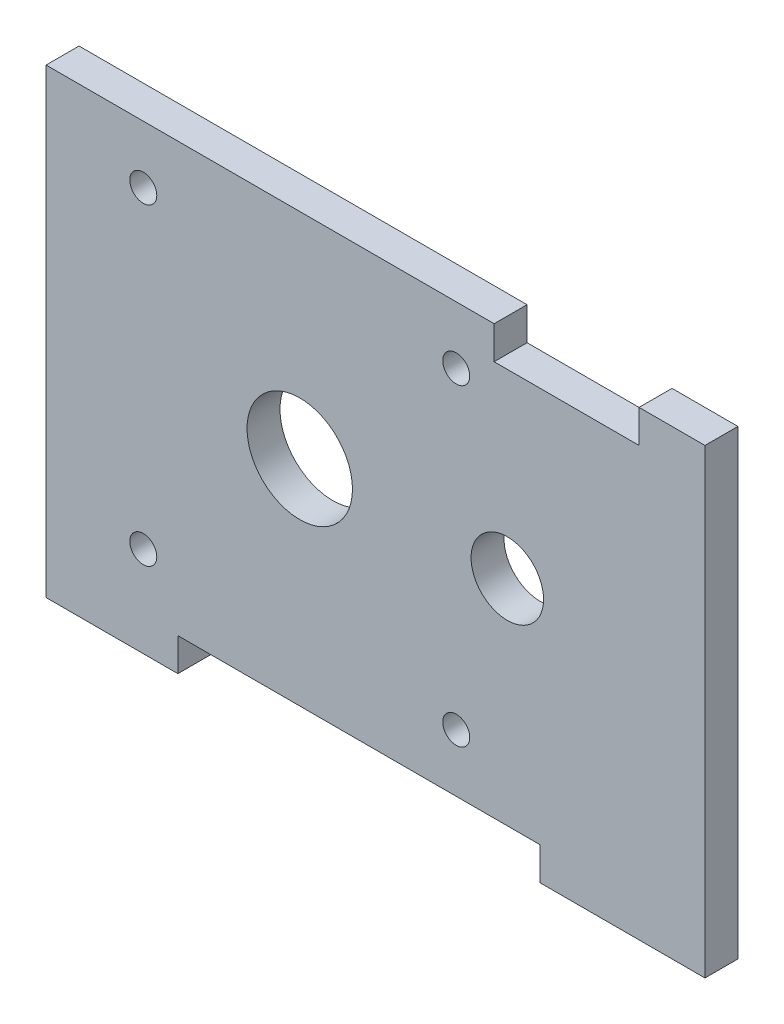
from build123d import *

# Parameters (mm, degrees)
SKETCH1_W           = 127
SKETCH1_H           = 82.55
SKETCH1_R           = 10.16
SKETCH1_R_2         = 6.985
SKETCH1_W_2         = 25.4
SKETCH1_H_2         = 6.35
SKETCH1_W_3         = 31.75
BOSS_EXTRUDE1_DEPTH = 6.35
SKETCH3_R           = 2.6035
CUT_EXTRUDE1_DEPTH  = 152.604172106
SKETCH4_W           = 27.94
SKETCH4_H           = 6.35
CUT_EXTRUDE2_DEPTH  = 6.35


with BuildPart() as part:
    # Sketch1 → Boss-Extrude1 (new body)
    # profile 1 of 3: a face of its own
    with BuildSketch(Plane.XY):
        with Locations((-63.5, 41.275)):
            Rectangle(SKETCH1_W, SKETCH1_H)
        with Locations((-78.105, 41.275)):
            Circle(SKETCH1_R, mode=Mode.SUBTRACT)
        with Locations((-38.1, 41.275)):
            Circle(SKETCH1_R_2, mode=Mode.SUBTRACT)
    # profile 2 of 3: a face of its own
    with BuildSketch(Plane.XY):
        with Locations((-114.3, -3.175)):
            Rectangle(SKETCH1_W_2, SKETCH1_H_2)
    # profile 3 of 3: a face of its own
    with BuildSketch(Plane.XY):
        with Locations((-15.875, -3.175)):
            Rectangle(SKETCH1_W_3, SKETCH1_H_2)
    extrude(amount=BOSS_EXTRUDE1_DEPTH)

    # Sketch3 → Cut-Extrude1 (cut, through all)
    with BuildSketch(Plane.XY.offset(6.35)):
        with Locations((-108.2675, 71.4375)):
            Circle(SKETCH3_R)
        with Locations((-47.9425, 71.4375)):
            Circle(SKETCH3_R)
        with Locations((-108.2675, 11.1125)):
            Circle(SKETCH3_R)
        with Locations((-47.9425, 11.1125)):
            Circle(SKETCH3_R)
    extrude(amount=-CUT_EXTRUDE1_DEPTH, mode=Mode.SUBTRACT)

    # Sketch4 → Cut-Extrude2 (cut)
    with BuildSketch(Plane(origin=(0, 0, 0), x_dir=(-1, 0, 0), z_dir=(0, 0, -1))):
        with Locations((26.67, 79.375)):
            Rectangle(SKETCH4_W, SKETCH4_H)
    extrude(amount=-CUT_EXTRUDE2_DEPTH, mode=Mode.SUBTRACT)


solid = part.part
